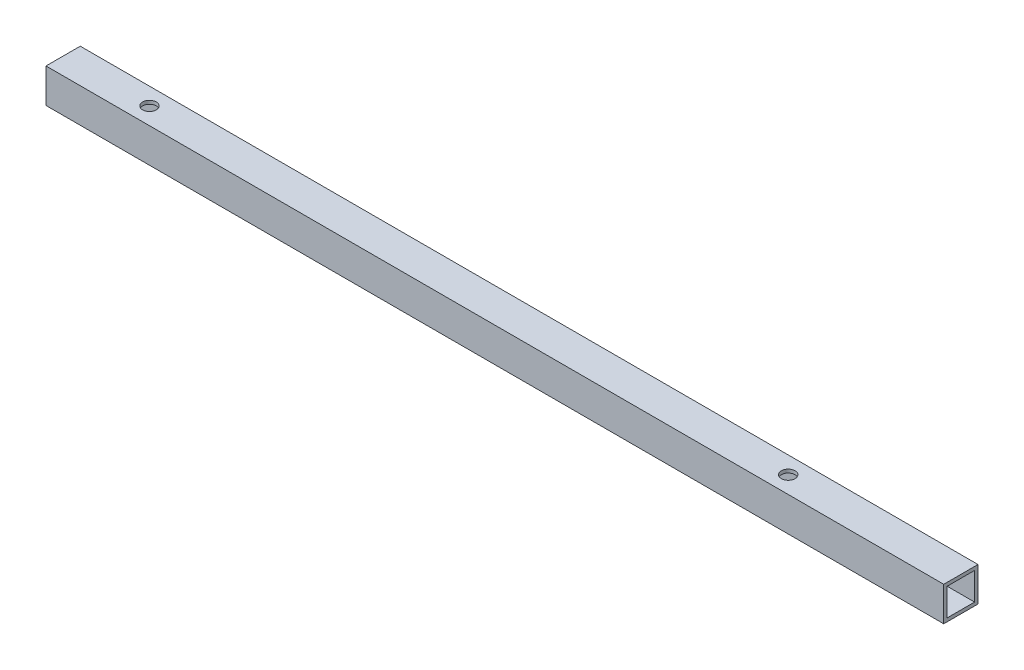
from build123d import *

# Parameters (mm, degrees)
SKETCH1_W           = 3.96875
SKETCH1_H           = 3.96875
BOSS_EXTRUDE1_DEPTH = 104
SKETCH2_W           = 3.175
SKETCH2_H           = 3.175
CUT_EXTRUDE1_DEPTH  = 105.037856035
SKETCH3_R           = 0.79375
CUT_EXTRUDE2_DEPTH  = 105.094614273
SKETCH4_R           = 0.79375
CUT_EXTRUDE3_DEPTH  = 105.094614273


with BuildPart() as part:
    # Sketch1 → Boss-Extrude1 (new body)
    with BuildSketch(Plane(origin=(0, 0, 0), x_dir=(0, 0, -1), z_dir=(1, 0, 0))):
        Rectangle(SKETCH1_W, SKETCH1_H)
    extrude(amount=BOSS_EXTRUDE1_DEPTH)

    # Sketch2 → Cut-Extrude1 (cut, through all)
    with BuildSketch(Plane.ZY):
        Rectangle(SKETCH2_W, SKETCH2_H)
    extrude(amount=-CUT_EXTRUDE1_DEPTH, mode=Mode.SUBTRACT)

    # Sketch3 → Cut-Extrude2 (cut, through all)
    with BuildSketch(Plane(origin=(0, 1.984375, 0), x_dir=(1, 0, 0), z_dir=(0, 1, 0))):
        with Locations(Location((10, 0, 0), (0, 0, 270))):
            Circle(SKETCH3_R)
    extrude(amount=-CUT_EXTRUDE2_DEPTH, mode=Mode.SUBTRACT)

    # Sketch4 → Cut-Extrude3 (cut, through all)
    with BuildSketch(Plane(origin=(0, 1.984375, 0), x_dir=(1, 0, 0), z_dir=(0, 1, 0))):
        with Locations(Location((84, 0, 0), (0, 0, 270))):
            Circle(SKETCH4_R)
    extrude(amount=-CUT_EXTRUDE3_DEPTH, mode=Mode.SUBTRACT)


solid = part.part
